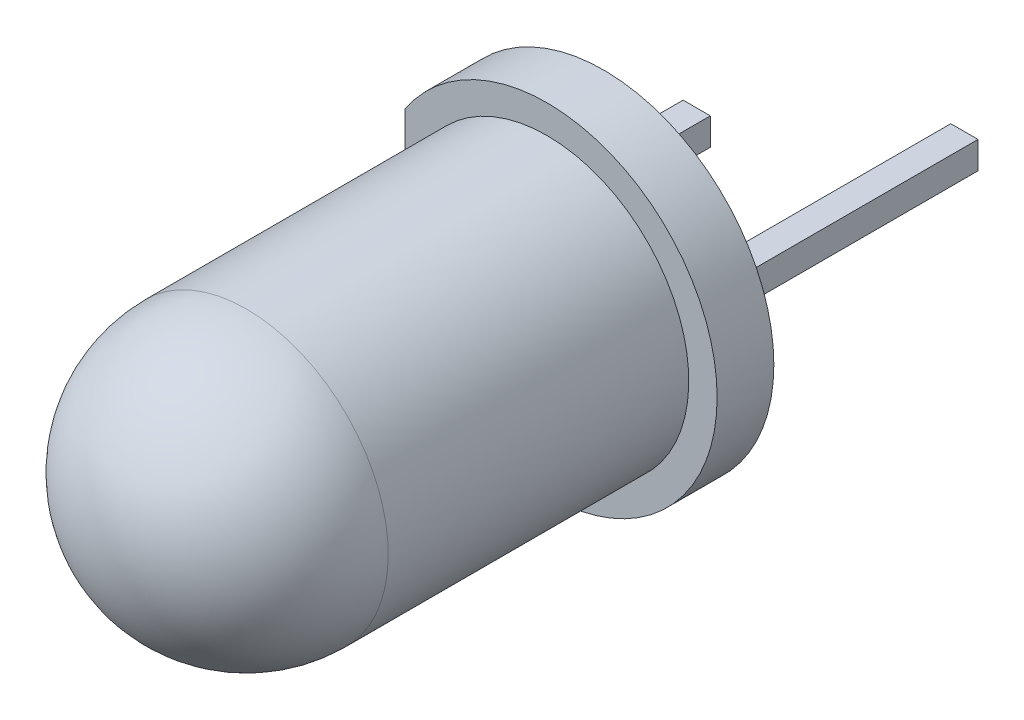
from build123d import *

# Parameters (mm, degrees)
ESBO_O1_R                  = 3
RESSALTO_EXTRUS_O1_DEPTH   = 1
CORTE_EXTRUS_O1_DEPTH      = 1
ESBO_O5_W                  = 0.48
ESBO_O5_H                  = 0.48
RESSALTO_EXTRUS_O2_DEPTH   = 3
RESSALTO_EXTRUS_O2_2_DEPTH = 3
ESBO_O6_W                  = 0.48
ESBO_O6_H                  = 0.48
RESSALTO_EXTRUS_O3_DEPTH   = 2
CORTE_EXTRUS_O2_DEPTH      = 0.24
RESSALTO_EXTRUS_O4_DEPTH   = 0.24
RESSALTO_EXTRUS_O4_2_DEPTH = 0.24
ESBO_O12_R                 = 0.2
CORTE_EXTRUS_O3_DEPTH      = 0.1


with BuildPart() as part:
    # Esboço1 → Ressalto-extrusão1 (new body)
    with BuildSketch(Plane.XY):
        Circle(ESBO_O1_R)
    extrude(amount=RESSALTO_EXTRUS_O1_DEPTH)

    # Esboço3 → Revolução1 (revolve)
    with BuildSketch(Plane(origin=(0, 0, 0), x_dir=(0, 0, -1), z_dir=(1, 0, 0))):
        with BuildLine():
            Line((-1, 0), (-8.8, 0))
            ThreePointArc((-8.8, 0), (-8.067766953, 1.767766953), (-6.3, 2.5))
            Line((-6.3, 2.5), (-1, 2.5))
            Line((-1, 2.5), (-1, 0))
        make_face()
    revolve(axis=Axis((0, 0, 1), (0, 0, 1)))

    # Esboço4 → Corte-extrusão1 (cut)
    with BuildSketch(Plane(origin=(0, 0, 0), x_dir=(-1, 0, 0), z_dir=(0, 0, -1))):
        with BuildLine():
            Line((2.5, 1.658312395), (2.5, -1.658312395))
            ThreePointArc((2.5, -1.658312395), (3, 0), (2.5, 1.658312395))
        make_face()
    extrude(amount=-CORTE_EXTRUS_O1_DEPTH, mode=Mode.SUBTRACT)

    # Esboço7 → Corte-extrusão2 (cut, symmetric)
    with BuildSketch(Plane(origin=(0, 0, 0), x_dir=(1, 0, 0), z_dir=(0, 1, 0))):
        Polygon((-1.6, 0), (-1.6, -3.5), (-1.3, -4), (1.2, -4), (0.02, -2), (-1.12, -2), (-1.12, 0), align=None)
        Polygon((1.6, 0), (1.6, -4), (1.4, -4), (0.22, -2), (1.12, -2), (1.12, 0), align=None)
    extrude(amount=CORTE_EXTRUS_O2_DEPTH, both=True, mode=Mode.SUBTRACT)


with BuildPart() as body_2:
    # Esboço5 → Ressalto-extrusão2 (new body)
    with BuildSketch(Plane(origin=(0, 0, 0), x_dir=(-1, 0, 0), z_dir=(0, 0, -1))):
        with Locations((-1.36, 0)):
            Rectangle(ESBO_O5_W, ESBO_O5_H)
    extrude(amount=RESSALTO_EXTRUS_O2_DEPTH)


with BuildPart() as body_3:
    # Esboço5 → Ressalto-extrus_o2 2 (new body)
    with BuildSketch(Plane(origin=(0, 0, 0), x_dir=(-1, 0, 0), z_dir=(0, 0, -1))):
        with Locations((1.36, 0)):
            Rectangle(ESBO_O5_W, ESBO_O5_H)
    extrude(amount=RESSALTO_EXTRUS_O2_2_DEPTH)


with BuildPart() as body_4:
    # Esboço6 → Ressalto-extrusão3 (new body)
    with BuildSketch(Plane(origin=(0, 0, -3), x_dir=(-1, 0, 0), z_dir=(0, 0, -1))):
        with Locations((-1.36, 0)):
            Rectangle(ESBO_O6_W, ESBO_O6_H)
    extrude(amount=RESSALTO_EXTRUS_O3_DEPTH)


with BuildPart() as body_5:
    # Esboço8 → Ressalto-extrusão4 (new, symmetric)
    with BuildSketch(Plane(origin=(0, 0, 0), x_dir=(1, 0, 0), z_dir=(0, 1, 0))):
        Polygon((-1.3, -4), (1.2, -4), (0.02, -2), (-1.12, -2), (-1.12, 0), (-1.6, 0), (-1.6, -3.5), align=None)
    extrude(amount=RESSALTO_EXTRUS_O4_DEPTH, both=True)

    # Combinar2: union body 3
    add(body_3.part)

    # Esboço10 → Corte-Revolução1 (revolve, cut)
    with BuildSketch(Plane(origin=(0, 0, 0), x_dir=(1, 0, 0), z_dir=(0, 1, 0))):
        with BuildLine():
            Line((-0.05, -4), (-0.05, -3.7))
            ThreePointArc((-0.05, -3.7), (-0.341547595, -3.780754009), (-0.55, -4))
            Line((-0.55, -4), (-0.05, -4))
        make_face()
    revolve(axis=Axis((-0.05, 0, 4), (0, 0, -1)), mode=Mode.SUBTRACT)


with BuildPart() as body_6:
    # Esboço8 → Ressalto-extrus_o4 2 (new, symmetric)
    with BuildSketch(Plane(origin=(0, 0, 0), x_dir=(1, 0, 0), z_dir=(0, 1, 0))):
        Polygon((0.22, -2), (1.4, -4), (1.6, -4), (1.6, 0), (1.12, 0), (1.12, -2), align=None)
    extrude(amount=RESSALTO_EXTRUS_O4_2_DEPTH, both=True)

    # Combinar1: union body 4, body 2
    add(body_4.part)
    add(body_2.part)


with BuildPart() as body_4_2:
    # Esboço11 → Revolução2 (revolve)
    with BuildSketch(Plane(origin=(0, 0, 0), x_dir=(1, 0, 0), z_dir=(0, 1, 0))):
        with BuildLine():
            Line((-0.55, -4), (-0.05, -4))
            Line((-0.05, -4), (-0.05, -3.7))
            ThreePointArc((-0.05, -3.7), (-0.341547595, -3.780754009), (-0.55, -4))
        make_face()
    revolve(axis=Axis((-0.05, 0, 4), (0, 0, -1)))

    # Combinar3: union body 5
    add(body_5.part)

    # Esboço12 → Corte-extrusão3 (cut)
    with BuildSketch(Plane.XY.offset(4)):
        with Locations((-0.05, 0)):
            Circle(ESBO_O12_R)
    extrude(amount=-CORTE_EXTRUS_O3_DEPTH, mode=Mode.SUBTRACT)


solid = Compound([part.part, body_6.part, body_4_2.part])
